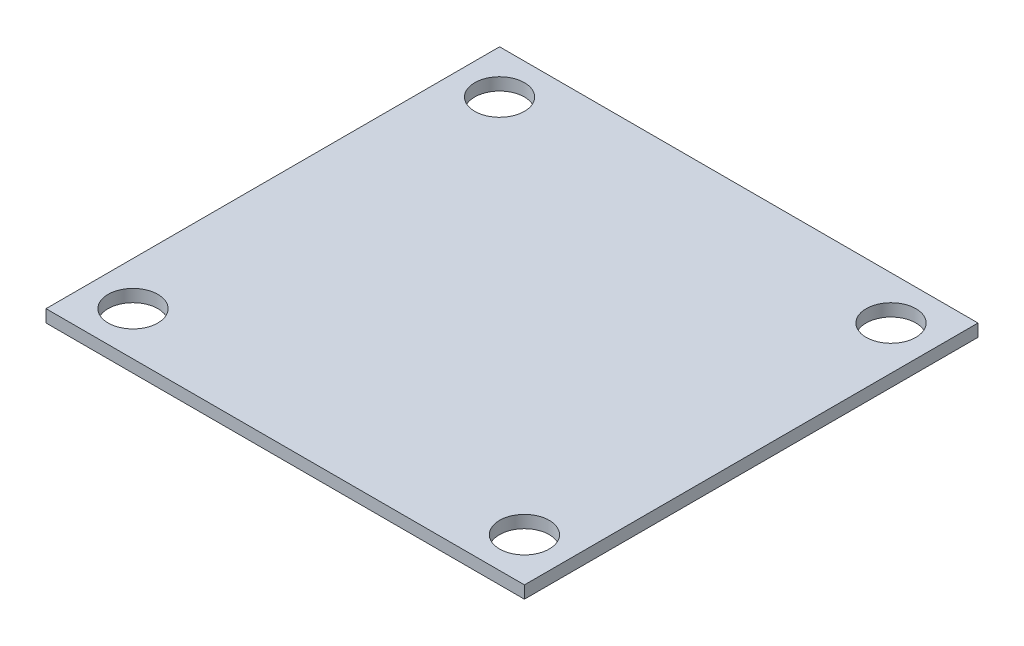
from build123d import *

# Parameters (mm, degrees)
CROQUIS1_W              = 38.5
CROQUIS1_H              = 36.5
CROQUIS1_R              = 2
SALIENTE_EXTRUIR1_DEPTH = 1


with BuildPart() as part:
    # Croquis1 → Saliente-Extruir1 (new body)
    with BuildSketch(Plane(origin=(0, 0, 0), x_dir=(1, 0, 0), z_dir=(0, 1, 0))):
        Rectangle(CROQUIS1_W, CROQUIS1_H)
        with Locations(Location((15.75, 14.75, 0), (0, 0, 270))):
            Circle(CROQUIS1_R, mode=Mode.SUBTRACT)
        with Locations(Location((-15.75, -14.75, 0), (0, 0, 270))):
            Circle(CROQUIS1_R, mode=Mode.SUBTRACT)
        with Locations(Location((15.75, -14.75, 0), (0, 0, 270))):
            Circle(CROQUIS1_R, mode=Mode.SUBTRACT)
        with Locations(Location((-15.75, 14.75, 0), (0, 0, 270))):
            Circle(CROQUIS1_R, mode=Mode.SUBTRACT)
    extrude(amount=SALIENTE_EXTRUIR1_DEPTH)


solid = part.part
